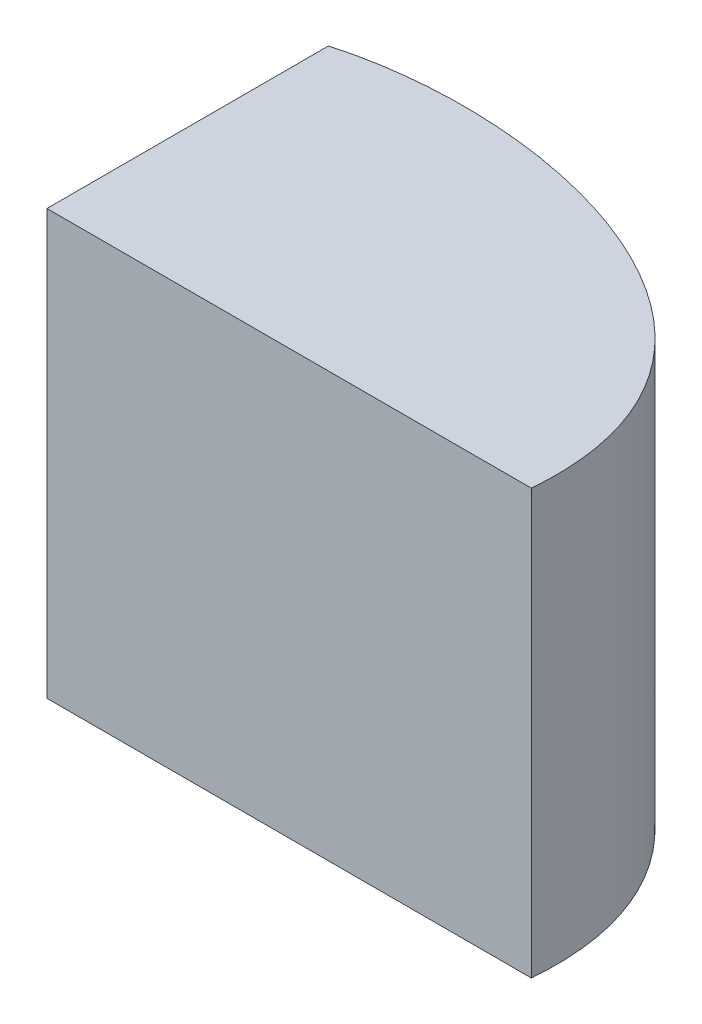
from build123d import *

# Parameters (mm, degrees)
EXTRUDE_1_DEPTH = 53


with BuildPart() as part:
    # 草图1 → 凸台-拉伸1 (new, symmetric)
    with BuildSketch(Plane(origin=(0, 0, 0), x_dir=(1, 0, 0), z_dir=(0, 1, 0))):
        with BuildLine():
            Line((59.731801374, -38.427023203), (-61.3002513, -38.427023203))
            Line((-61.3002513, -38.427023203), (-61.3002513, 31.891815175))
            add(Edge.make_bspline(
                [(-61.3002513, 31.891815175), (-14.935887617, 45.201796535), (65.170920947, 25.308509373), (59.731801374, -38.427023203)],
                knots=[0, 0, 0, 0, 1, 1, 1, 1], degree=3))
        make_face()
    extrude(amount=EXTRUDE_1_DEPTH, both=True)


solid = part.part
